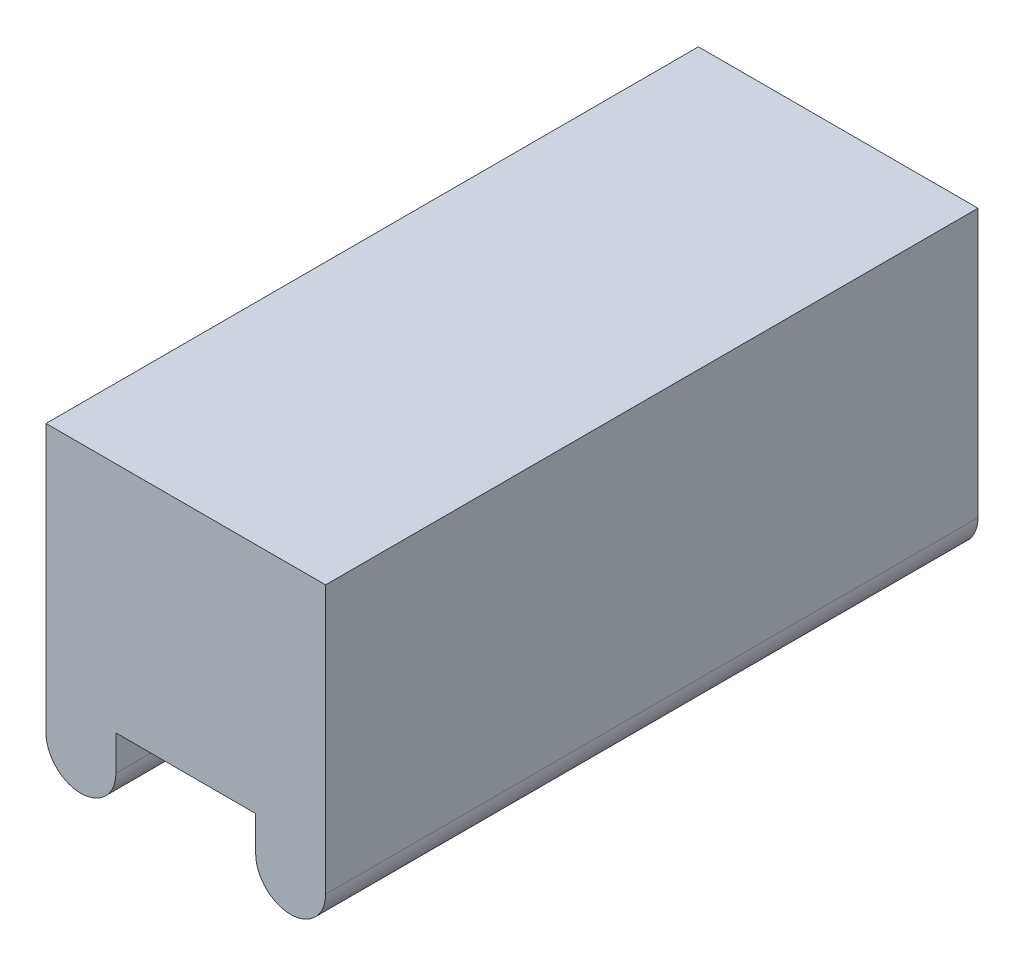
from build123d import *

# Parameters (mm, degrees)
BOSS_EXTRUDE1_DEPTH = 28


with BuildPart() as part:
    # Sketch1 → Boss-Extrude1 (new body)
    with BuildSketch(Plane.XY):
        with BuildLine():
            Line((-3, -5), (3, -5))
            Line((3, -5), (3, -6.5))
            ThreePointArc((3, -6.5), (4.5, -8), (6, -6.5))
            Line((6, -6.5), (6, -5))
            Line((6, -5), (6, 5))
            Line((6, 5), (-6, 5))
            Line((-6, 5), (-6, -5))
            Line((-6, -5), (-6, -6.5))
            ThreePointArc((-6, -6.5), (-4.5, -8), (-3, -6.5))
            Line((-3, -6.5), (-3, -5))
        make_face()
    extrude(amount=BOSS_EXTRUDE1_DEPTH)


solid = part.part
